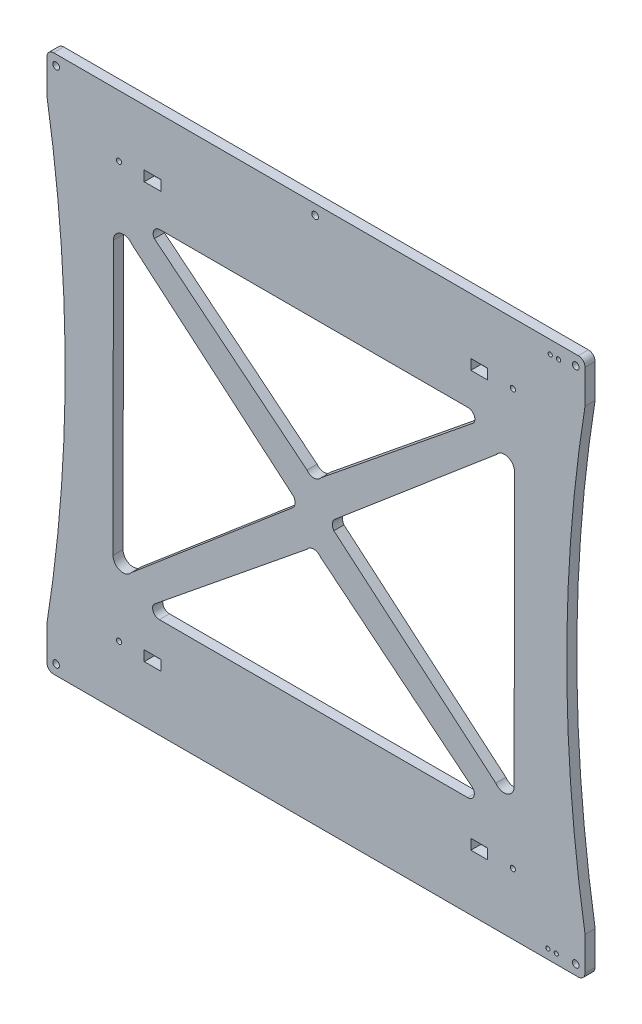
from build123d import *

# Parameters (mm, degrees)
SKETCH_1_R      = 2
SKETCH_1_R_2    = 1.55
SKETCH_1_R_3    = 1.25
SKETCH_1_W      = 10
SKETCH_1_H      = 6.1
EXTRUDE_1_DEPTH = 6


with BuildPart() as part:
    # Эскиз1 → Бобышка-Вытянуть1 (new body)
    with BuildSketch(Plane.XY):
        with BuildLine():
            Line((160, 156), (160, 136))
            ThreePointArc((160, 136), (149.118825479, 0), (160, -136))
            Line((160, -136), (160, -156))
            ThreePointArc((160, -156), (158.828427125, -158.828427125), (156, -160))
            Line((156, -160), (136, -160))
            Line((136, -160), (-156, -160))
            ThreePointArc((-156, -160), (-158.828427125, -158.828427125), (-160, -156))
            Line((-160, -156), (-160, -136))
            ThreePointArc((-160, -136), (-149.118825479, 0), (-160, 136))
            Line((-160, 136), (-160, 156))
            ThreePointArc((-160, 156), (-158.828427125, 158.828427125), (-156, 160))
            Line((-156, 160), (136, 160))
            Line((136, 160), (156, 160))
            ThreePointArc((156, 160), (158.828427125, 158.828427125), (160, 156))
        make_face()
        with Locations((-154.5, 154)):
            Circle(SKETCH_1_R, mode=Mode.SUBTRACT)
        with Locations((-154.5, -154)):
            Circle(SKETCH_1_R, mode=Mode.SUBTRACT)
        with Locations((154.5, 154)):
            Circle(SKETCH_1_R, mode=Mode.SUBTRACT)
        with Locations((154.5, -154)):
            Circle(SKETCH_1_R, mode=Mode.SUBTRACT)
        with Locations((117.1, -123.55)):
            Circle(SKETCH_1_R_2, mode=Mode.SUBTRACT)
        with Locations((-117.1, -123.55)):
            Circle(SKETCH_1_R_2, mode=Mode.SUBTRACT)
        with Locations((-117.1, 123.55)):
            Circle(SKETCH_1_R_2, mode=Mode.SUBTRACT)
        with Locations((117.1, 123.55)):
            Circle(SKETCH_1_R_2, mode=Mode.SUBTRACT)
        with Locations((142.88852833, -154.406847052)):
            Circle(SKETCH_1_R_3, mode=Mode.SUBTRACT)
        with Locations((137.91717333, -154.338989052)):
            Circle(SKETCH_1_R_3, mode=Mode.SUBTRACT)
        with Locations((-0.5, 154)):
            Circle(SKETCH_1_R, mode=Mode.SUBTRACT)
        with Locations((144.264881547, 152.244611453)):
            Circle(SKETCH_1_R_3, mode=Mode.SUBTRACT)
        with Locations((139.293526547, 152.312469453)):
            Circle(SKETCH_1_R_3, mode=Mode.SUBTRACT)
        with Locations((97.1, 123.55)):
            Rectangle(SKETCH_1_W, SKETCH_1_H, mode=Mode.SUBTRACT)
        with Locations((-97.1, -123.55)):
            Rectangle(SKETCH_1_W, SKETCH_1_H, mode=Mode.SUBTRACT)
        with Locations((97.1, -123.55)):
            Rectangle(SKETCH_1_W, SKETCH_1_H, mode=Mode.SUBTRACT)
        with Locations((-97.1, 123.55)):
            Rectangle(SKETCH_1_W, SKETCH_1_H, mode=Mode.SUBTRACT)
        with BuildLine():
            Line((93.489652385, -94.205074627), (2.780610095, -20.466408797))
            ThreePointArc((2.780610095, -20.466408797), (-1.333842507, -18.299575929), (-5.45296535, -20.457517519))
            Line((-5.45296535, -20.457517519), (-96.398158259, -94.197961604))
            ThreePointArc((-96.398158259, -94.197961604), (-96.649394743, -98.329753251), (-93.107179505, -100.471606))
            Line((-93.107179505, -100.471606), (90.193770783, -100.471606))
            ThreePointArc((90.193770783, -100.471606), (93.73397738, -98.333577335), (93.489652385, -94.205074627))
        make_face(mode=Mode.SUBTRACT)
        with BuildLine():
            Line((-5.393845546, 20.503538093), (-96.102893823, 94.242212627))
            ThreePointArc((-96.102893823, 94.242212627), (-96.347218817, 98.370715335), (-92.807012221, 100.508744))
            Line((-92.807012221, 100.508744), (90.493950067, 100.508744))
            ThreePointArc((90.493950067, 100.508744), (94.036165305, 98.366891251), (93.784928821, 94.235099604))
            Line((93.784928821, 94.235099604), (2.839729898, 20.494646814))
            ThreePointArc((2.839729898, 20.494646814), (-1.279392944, 18.336705225), (-5.393845546, 20.503538093))
        make_face(mode=Mode.SUBTRACT)
        with BuildLine():
            Line((-109.763358937, -84.575917132), (-13.303284143, -2.757613876))
            ThreePointArc((-13.303284143, -2.757613876), (-12.418558312, 0.078161869), (-13.298704681, 2.915362292))
            Line((-13.298704681, 2.915362292), (-109.49916318, 84.639383129))
            ThreePointArc((-109.49916318, 84.639383129), (-116.218458744, 86.97087694), (-120.442977971, 81.249143499))
            Line((-120.442977971, 81.249143499), (-120.701678374, -81.158585361))
            ThreePointArc((-120.701678374, -81.158585361), (-116.49090996, -86.895155762), (-109.763358937, -84.575917132))
        make_face(mode=Mode.SUBTRACT)
        with BuildLine():
            Line((106.88592289, -84.602246797), (10.646219109, -2.821157348))
            ThreePointArc((10.646219109, -2.821157348), (9.766074027, 0.017406269), (10.652347669, 2.854062364))
            Line((10.652347669, 2.854062364), (107.15201684, 84.634313992))
            ThreePointArc((107.15201684, 84.634313992), (113.879270457, 86.95037229), (118.088477358, 81.21428961))
            Line((118.088477358, 81.21428961), (117.82973768, -81.212007525))
            ThreePointArc((117.82973768, -81.212007525), (113.605218283, -86.933740662), (106.88592289, -84.602246797))
        make_face(mode=Mode.SUBTRACT)
    extrude(amount=EXTRUDE_1_DEPTH)


solid = part.part
